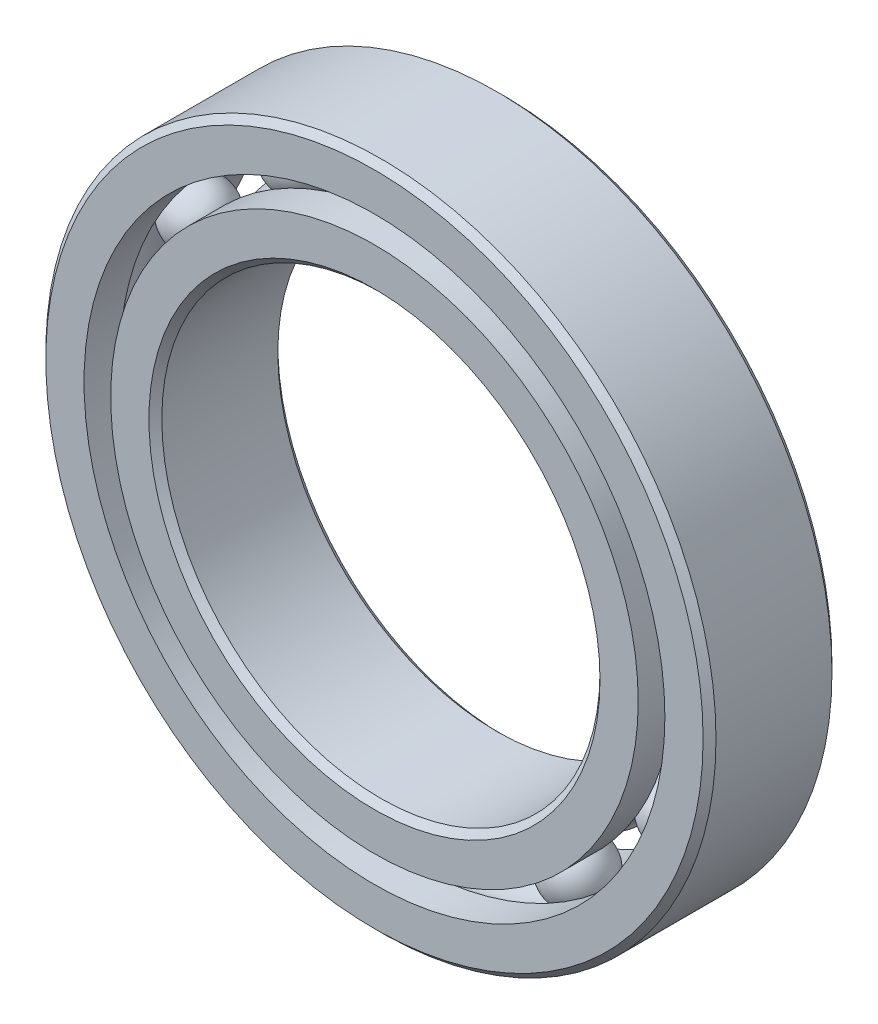
from build123d import *

# Parameters (mm, degrees)
CIRPATTERN1_COUNT = 12


with BuildPart() as part:
    # Sketch1 → Revolve1 (revolve)
    with BuildSketch(Plane(origin=(0, 0, 0), x_dir=(0, 0, -1), z_dir=(1, 0, 0)), mode=Mode.PRIVATE) as revolve1_sk:
        with BuildLine():
            Line((2.25, 13), (-2.25, 13))
            Line((-2.25, 13), (-2.5, 12.75))
            Line((-2.5, 12.75), (-2.5, 11.267365936))
            Line((-2.5, 11.267365936), (-1.111111111, 11.267365936))
            ThreePointArc((-1.111111111, 11.267365936), (0, 11.975657135), (1.111111111, 11.267365936))
            Line((1.111111111, 11.267365936), (2.5, 11.267365936))
            Line((2.5, 11.267365936), (2.5, 12.75))
            Line((2.5, 12.75), (2.25, 13))
        make_face()
    revolve(revolve1_sk.sketch.rotate(Axis((0, 0, 2.5), (0, 0, -1)), 90), axis=Axis((0, 0, 2.5), (0, 0, -1)))


with BuildPart() as body_2:
    # Sketch3 → Revolve3 (revolve)
    with BuildSketch(Plane(origin=(0, 0, 0), x_dir=(0, 0, -1), z_dir=(1, 0, 0)), mode=Mode.PRIVATE) as revolve3_sk:
        with BuildLine():
            Line((-2.5, 10.232634064), (-1.111111111, 10.232634064))
            ThreePointArc((-1.111111111, 10.232634064), (0, 9.524342865), (1.111111111, 10.232634064))
            Line((1.111111111, 10.232634064), (2.5, 10.232634064))
            Line((2.5, 10.232634064), (2.5, 8.75))
            Line((2.5, 8.75), (2.25, 8.5))
            Line((2.25, 8.5), (-2.25, 8.5))
            Line((-2.25, 8.5), (-2.5, 8.75))
            Line((-2.5, 8.75), (-2.5, 10.232634064))
        make_face()
    revolve(revolve3_sk.sketch.rotate(Axis((0, 0, 2.5), (0, 0, -1)), 90), axis=Axis((0, 0, 2.5), (0, 0, -1)))


with BuildPart() as body_3:
    # Sketch4 → Revolve4 (revolve)
    with BuildSketch(Plane(origin=(0, 0, 0), x_dir=(0, 0, -1), z_dir=(1, 0, 0))):
        with BuildLine():
            Line((-1.225657135, 10.75), (1.225657135, 10.75))
            ThreePointArc((1.225657135, 10.75), (0, 11.975657135), (-1.225657135, 10.75))
        make_face()
    revolve(axis=Axis((0, 10.75, 1.225657135), (0, 0, -1)))


with BuildPart() as cirpattern1_1:
    # CirPattern1: pattern copy
    add(body_3.part.rotate(Axis((0, 0, 0), (0, 0, 1)), 1 * 360 / CIRPATTERN1_COUNT))


with BuildPart() as cirpattern1_2:
    # CirPattern1: pattern copy
    add(body_3.part.rotate(Axis((0, 0, 0), (0, 0, 1)), 2 * 360 / CIRPATTERN1_COUNT))


with BuildPart() as cirpattern1_3:
    # CirPattern1: pattern copy
    add(body_3.part.rotate(Axis((0, 0, 0), (0, 0, 1)), 3 * 360 / CIRPATTERN1_COUNT))


with BuildPart() as cirpattern1_4:
    # CirPattern1: pattern copy
    add(body_3.part.rotate(Axis((0, 0, 0), (0, 0, 1)), 4 * 360 / CIRPATTERN1_COUNT))


with BuildPart() as cirpattern1_5:
    # CirPattern1: pattern copy
    add(body_3.part.rotate(Axis((0, 0, 0), (0, 0, 1)), 5 * 360 / CIRPATTERN1_COUNT))


with BuildPart() as cirpattern1_6:
    # CirPattern1: pattern copy
    add(body_3.part.rotate(Axis((0, 0, 0), (0, 0, 1)), 6 * 360 / CIRPATTERN1_COUNT))


with BuildPart() as cirpattern1_7:
    # CirPattern1: pattern copy
    add(body_3.part.rotate(Axis((0, 0, 0), (0, 0, 1)), 7 * 360 / CIRPATTERN1_COUNT))


with BuildPart() as cirpattern1_8:
    # CirPattern1: pattern copy
    add(body_3.part.rotate(Axis((0, 0, 0), (0, 0, 1)), 8 * 360 / CIRPATTERN1_COUNT))


with BuildPart() as cirpattern1_9:
    # CirPattern1: pattern copy
    add(body_3.part.rotate(Axis((0, 0, 0), (0, 0, 1)), 9 * 360 / CIRPATTERN1_COUNT))


with BuildPart() as cirpattern1_10:
    # CirPattern1: pattern copy
    add(body_3.part.rotate(Axis((0, 0, 0), (0, 0, 1)), 10 * 360 / CIRPATTERN1_COUNT))


with BuildPart() as cirpattern1_11:
    # CirPattern1: pattern copy
    add(body_3.part.rotate(Axis((0, 0, 0), (0, 0, 1)), 11 * 360 / CIRPATTERN1_COUNT))


solid = Compound([part.part, body_2.part, body_3.part, cirpattern1_1.part, cirpattern1_2.part, cirpattern1_3.part, cirpattern1_4.part, cirpattern1_5.part, cirpattern1_6.part, cirpattern1_7.part, cirpattern1_8.part, cirpattern1_9.part, cirpattern1_10.part, cirpattern1_11.part])
